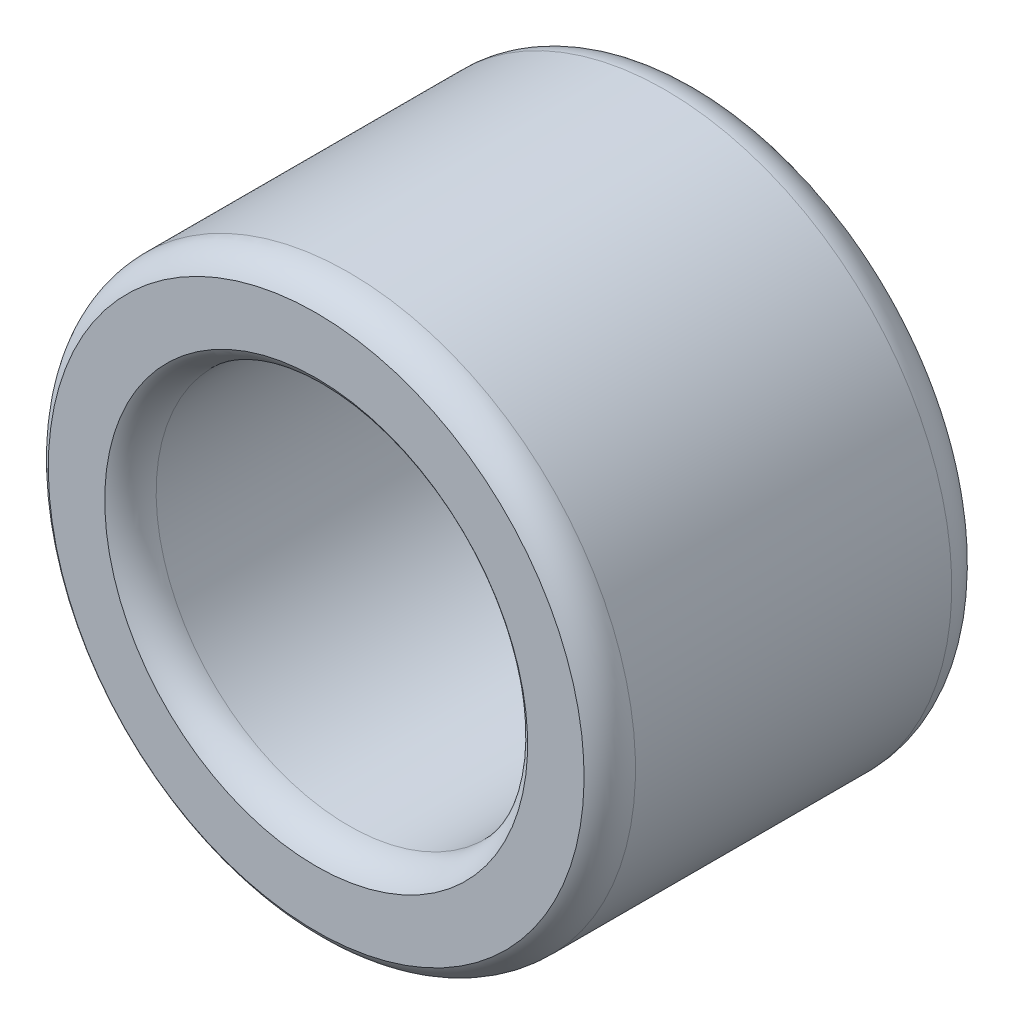
from build123d import *

# Parameters (mm, degrees)
SKETCH3_R           = 4.77266
SKETCH3_R_2         = 3.20675
BOSS_EXTRUDE1_DEPTH = 3.175


with BuildPart() as part:
    # Sketch3 → Boss-Extrude1 (new, symmetric)
    with BuildSketch(Plane.XY):
        Circle(SKETCH3_R)
        Circle(SKETCH3_R_2, mode=Mode.SUBTRACT)
    extrude(amount=BOSS_EXTRUDE1_DEPTH, both=True)

    # Sketch4 → Cut-Revolve1 (revolve, cut)
    with BuildSketch(Plane(origin=(0, 0, 0), x_dir=(0, 0, -1), z_dir=(1, 0, 0))):
        with BuildLine():
            Line((-2.632552864, 4.77266), (-3.175, 4.77266))
            Line((-3.175, 4.77266), (-3.175, 4.459478))
            ThreePointArc((-3.175, 4.459478), (-2.945734864, 4.688743136), (-2.632552864, 4.77266))
        make_face()
        with BuildLine():
            Line((-2.632552864, 3.20675), (-3.175, 3.20675))
            Line((-3.175, 3.20675), (-3.175, 3.519932))
            ThreePointArc((-3.175, 3.519932), (-2.945734864, 3.290666864), (-2.632552864, 3.20675))
        make_face()
        with BuildLine():
            Line((3.175, 3.20675), (3.175, 3.519932))
            ThreePointArc((3.175, 3.519932), (2.945734864, 3.290666864), (2.632552864, 3.20675))
            Line((2.632552864, 3.20675), (3.175, 3.20675))
        make_face()
        with BuildLine():
            Line((3.175, 4.77266), (3.175, 4.459478))
            ThreePointArc((3.175, 4.459478), (2.945734864, 4.688743136), (2.632552864, 4.77266))
            Line((2.632552864, 4.77266), (3.175, 4.77266))
        make_face()
    revolve(axis=Axis((0, 0, -3.175), (0, 0, 1)), mode=Mode.SUBTRACT)


solid = part.part
